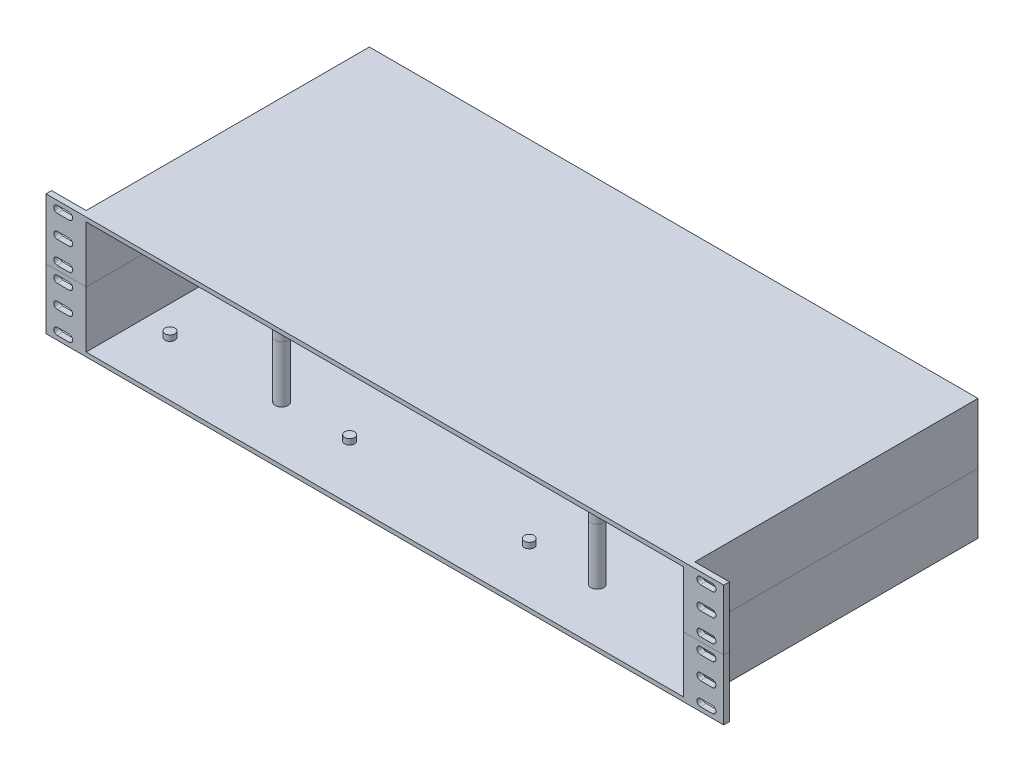
from build123d import *

# Parameters (mm, degrees)
SKETCH2_W               = 432
SKETCH2_H               = 205
BOSS_EXTRUDE1_DEPTH     = 3
BOSS_EXTRUDE2_DEPTH     = 40
SKETCH4_R               = 3.5
BOSS_EXTRUDE3_DEPTH     = 4
SKETCH5_R               = 4.5
BOSS_EXTRUDE4_DEPTH     = 40
SKETCH6_W               = 24.5
SKETCH6_H               = 43
BOSS_EXTRUDE5_DEPTH     = 4
MIRROR5_COPY_1_SKETCH_R = 3.5
MIRROR5_COPY_1_DEPTH    = 4
MIRROR5_COPY_2_SKETCH_R = 4.5
MIRROR5_COPY_2_DEPTH    = 40
SKETCH7_W               = 166.323191252
SKETCH7_H               = 37.444488083
CUT_EXTRUDE1_DEPTH      = 62


with BuildPart() as part:
    # Sketch2 → Boss-Extrude1 (new body)
    with BuildSketch(Plane(origin=(0, 0, 0), x_dir=(1, 0, 0), z_dir=(0, 1, 0))):
        Rectangle(SKETCH2_W, SKETCH2_H)
    extrude(amount=BOSS_EXTRUDE1_DEPTH)

    # Sketch3 → Boss-Extrude2 (add)
    with BuildSketch(Plane(origin=(0, 3, 0), x_dir=(1, 0, 0), z_dir=(0, 1, 0))):
        Polygon((216, -102.5), (212, -102.5), (212, 98.3), (-212, 98.3), (-212, -102.5), (-216, -102.5), (-216, 102.5), (216, 102.5), align=None)
    extrude(amount=BOSS_EXTRUDE2_DEPTH)

    # Sketch4 → Boss-Extrude3 (add)
    with BuildSketch(Plane(origin=(0, 3, 0), x_dir=(1, 0, 0), z_dir=(0, 1, 0))):
        with Locations(Location((63.75, 63.75, 0), (0, 0, 270))):
            Circle(SKETCH4_R)
        with Locations(Location((191.25, 63.75, 0), (0, 0, 270))):
            Circle(SKETCH4_R)
    boss_extrude3 = extrude(amount=BOSS_EXTRUDE3_DEPTH)

    # Sketch5 → Boss-Extrude4 (add)
    with BuildSketch(Plane(origin=(0, 3, 0), x_dir=(1, 0, 0), z_dir=(0, 1, 0))):
        with Locations(Location((112, 63.75, 0), (0, 0, 270))):
            Circle(SKETCH5_R)
    boss_extrude4 = extrude(amount=BOSS_EXTRUDE4_DEPTH)

    # Sketch6 → Boss-Extrude5 (add)
    with BuildSketch(Plane.XY.offset(102.5)):
        with Locations((228.25, 21.5)):
            Rectangle(SKETCH6_W, SKETCH6_H)
        with BuildLine():
            Line((224, 24), (232.5, 24))
            ThreePointArc((232.5, 24), (235, 21.5), (232.5, 19))
            Line((232.5, 19), (224, 19))
            ThreePointArc((224, 19), (221.5, 21.5), (224, 24))
        make_face(mode=Mode.SUBTRACT)
        with BuildLine():
            Line((224, 40), (232.5, 40))
            ThreePointArc((232.5, 40), (235, 37.5), (232.5, 35))
            Line((232.5, 35), (224, 35))
            ThreePointArc((224, 35), (221.5, 37.5), (224, 40))
        make_face(mode=Mode.SUBTRACT)
        with BuildLine():
            Line((224, 8), (232.5, 8))
            ThreePointArc((232.5, 8), (235, 5.5), (232.5, 3))
            Line((232.5, 3), (224, 3))
            ThreePointArc((224, 3), (221.5, 5.5), (224, 8))
        make_face(mode=Mode.SUBTRACT)
    boss_extrude5 = extrude(amount=-BOSS_EXTRUDE5_DEPTH)

    # Mirror3: Boss-Extrude5 across plane
    add(boss_extrude5.mirror(Plane(origin=(0, 0, 0), x_dir=(0, 0, 1), z_dir=(1, 0, 0))))

    # Mirror4: Boss-Extrude3, Boss-Extrude4 across plane
    add(boss_extrude3.mirror(Plane(origin=(0, 0, 0), x_dir=(0, 0, 1), z_dir=(1, 0, 0))))
    add(boss_extrude4.mirror(Plane(origin=(0, 0, 0), x_dir=(0, 0, 1), z_dir=(1, 0, 0))))

    # Mirror5: Boss-Extrude3, Boss-Extrude4 across plane
    add(boss_extrude3.mirror(Plane.XY))
    add(boss_extrude4.mirror(Plane.XY))

    # Mirror5 copy 1 sketch → Mirror5 copy 1 (add)
    with BuildSketch(Plane(origin=(0, 3, 0), x_dir=(-1, 0, 0), z_dir=(0, 1, 0))):
        with Locations(Location((63.75, 63.75, 0), (0, 0, 270))):
            Circle(MIRROR5_COPY_1_SKETCH_R)
        with Locations(Location((191.25, 63.75, 0), (0, 0, 270))):
            Circle(MIRROR5_COPY_1_SKETCH_R)
    extrude(amount=MIRROR5_COPY_1_DEPTH)

    # Mirror5 copy 2 sketch → Mirror5 copy 2 (add)
    with BuildSketch(Plane(origin=(0, 3, 0), x_dir=(-1, 0, 0), z_dir=(0, 1, 0))):
        with Locations(Location((112, 63.75, 0), (0, 0, 270))):
            Circle(MIRROR5_COPY_2_SKETCH_R)
    extrude(amount=MIRROR5_COPY_2_DEPTH)


with BuildPart() as body_2:
    # Mirror6: mirrored copy
    add(part.part.mirror(Plane.ZX.offset(43)))


with BuildPart() as cut_extrude1_tool:
    # Sketch7 → Cut-Extrude1 (new body)
    with BuildSketch(Plane(origin=(0, 3, 0), x_dir=(1, 0, 0), z_dir=(0, 1, 0))):
        with Locations((128.270066894, 61.868005143)):
            Rectangle(SKETCH7_W, SKETCH7_H)
    extrude(amount=CUT_EXTRUDE1_DEPTH)


with BuildPart() as part_1:
    add(part.part)

    # Cut-Extrude1: cut by cut_extrude1_tool
    add(cut_extrude1_tool.part, mode=Mode.SUBTRACT)


with BuildPart() as body_2_1:
    add(body_2.part)

    # Cut-Extrude1: cut by cut_extrude1_tool
    add(cut_extrude1_tool.part, mode=Mode.SUBTRACT)


solid = Compound([part_1.part, body_2_1.part])
